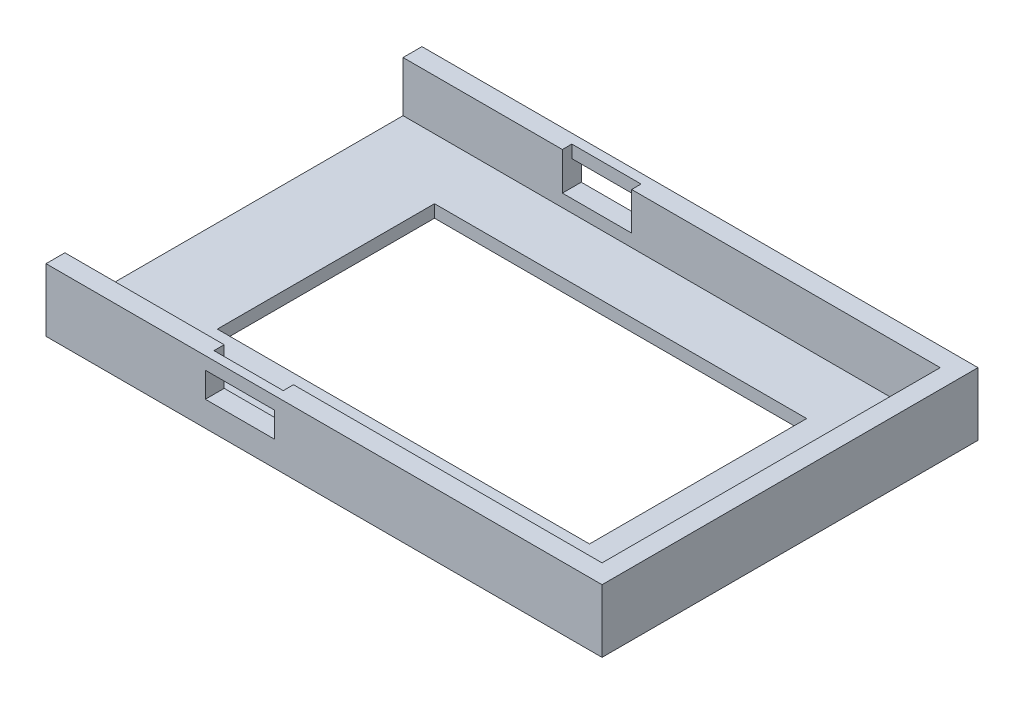
from build123d import *

# Parameters (mm, degrees)
SKETCH_1_W          = 88.3
SKETCH_1_H          = 59.7
SKETCH_1_W_2        = 82.3
SKETCH_1_H_2        = 53.7
EXTRUDE_1_DEPTH     = 8
SKETCH_2_W          = 88.3
SKETCH_2_H          = 59.7
EXTRUDE_2_DEPTH     = 2
SKETCH_3_W          = 59.09959803
SKETCH_3_H          = 34.490013092
CUT_EXTRUDE_1_DEPTH = 2
SKETCH_4_W          = 3
SKETCH_4_H          = 53.7
CUT_EXTRUDE_2_DEPTH = 8
SKETCH_5_W          = 11
SKETCH_5_H          = 3
CUT_EXTRUDE_3_DEPTH = 6
SKETCH_6_W          = 1.375438735
SKETCH_6_H          = 2
EXTRUDE_3_DEPTH     = 11
EXTRUDE_4_REACH     = 62.49
SKETCH_7_W          = 1.5
SKETCH_7_H          = 2


with BuildPart() as part:
    # 草图1 → 凸台-拉伸1 (new body)
    with BuildSketch(Plane(origin=(0, 0, 0), x_dir=(1, 0, 0), z_dir=(0, 1, 0))):
        Rectangle(SKETCH_1_W, SKETCH_1_H)
        Rectangle(SKETCH_1_W_2, SKETCH_1_H_2, mode=Mode.SUBTRACT)
    extrude(amount=EXTRUDE_1_DEPTH)

    # 草图2 → 凸台-拉伸2 (add)
    with BuildSketch(Plane.XZ):
        Rectangle(SKETCH_2_W, SKETCH_2_H)
    extrude(amount=EXTRUDE_2_DEPTH)

    # 草图3 → 切除-拉伸1 (cut)
    with BuildSketch(Plane(origin=(0, 0, 0), x_dir=(1, 0, 0), z_dir=(0, 1, 0))):
        Rectangle(SKETCH_3_W, SKETCH_3_H)
    extrude(amount=-CUT_EXTRUDE_1_DEPTH, mode=Mode.SUBTRACT)

    # 草图4 → 切除-拉伸2 (cut)
    with BuildSketch(Plane(origin=(0, 8, 0), x_dir=(1, 0, 0), z_dir=(0, 1, 0))):
        with Locations((-42.65, 0)):
            Rectangle(SKETCH_4_W, SKETCH_4_H)
    extrude(amount=-CUT_EXTRUDE_2_DEPTH, mode=Mode.SUBTRACT)

    # 草图5 → 切除-拉伸3 (cut)
    with BuildSketch(Plane(origin=(0, 8, 0), x_dir=(1, 0, 0), z_dir=(0, 1, 0))):
        with Locations((-13.35, 28.35)):
            Rectangle(SKETCH_5_W, SKETCH_5_H)
        with Locations((-13.35, -28.35)):
            Rectangle(SKETCH_5_W, SKETCH_5_H)
    extrude(amount=-CUT_EXTRUDE_3_DEPTH, mode=Mode.SUBTRACT)

    # 草图6 → 凸台-拉伸3 (add)
    with BuildSketch(Plane.ZY.offset(7.85)):
        with Locations((29.162280632, 7)):
            Rectangle(SKETCH_6_W, SKETCH_6_H)
    extrude(amount=EXTRUDE_3_DEPTH)

    # 草图7 → 凸台-拉伸4 (add, up to next)
    with BuildSketch(Plane.ZY.offset(7.85), mode=Mode.PRIVATE) as extrude_4_sk1:
        with Locations((-29.1, 7)):
            Rectangle(SKETCH_7_W, SKETCH_7_H)
    extrude_4_tool1 = extrude(extrude_4_sk1.sketch, amount=EXTRUDE_4_REACH, mode=Mode.PRIVATE) - part.part
    add(extrude_4_tool1.solids().sort_by_distance((-7.85, 7, -29.1))[0])


solid = part.part
